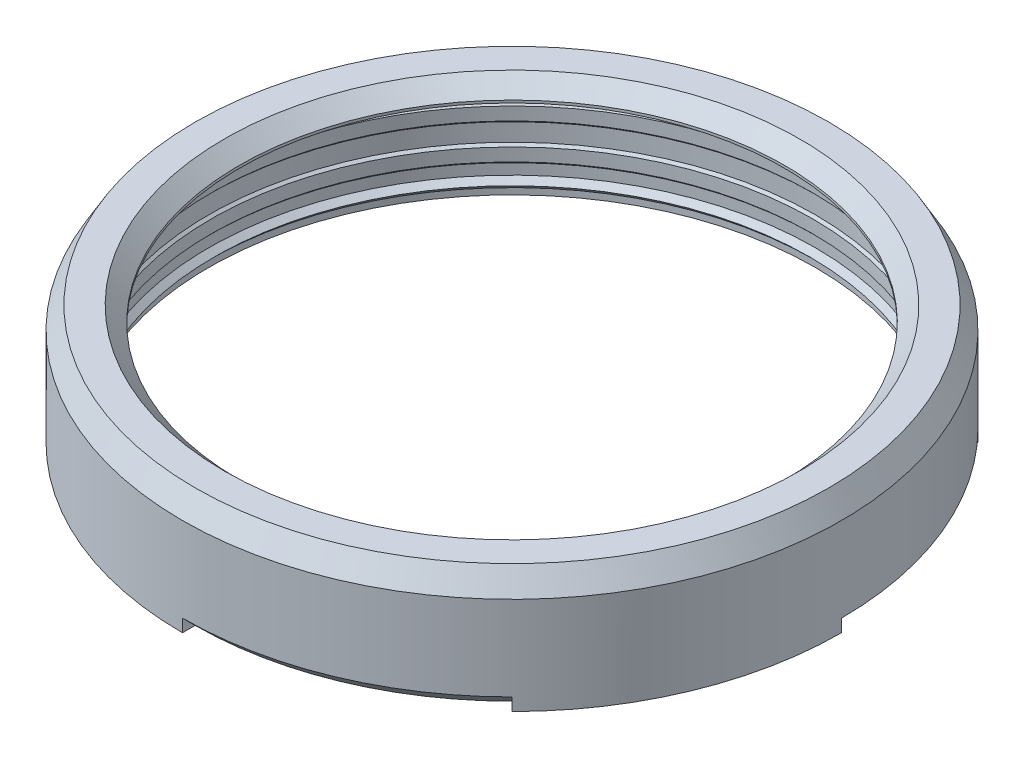
from build123d import *

# Parameters (mm, degrees)
SKETCH_1_R               = 26
EXTRUDE_1_DEPTH          = 2
SKETCH_5_R               = 21.5
CUT_EXTRUDE_1_DEPTH      = 39.105117767
CUT_EXTRUDE_START        = -0.6
SKETCH_7_R               = 26
CUT_EXTRUDE_2_DEPTH      = 0.6
CHAMFER_1_SIZE           = 1.732
CHAMFER_1_SIZE2          = 0.999970666
CHAMFER_2_SIZE           = 1.2
CUT_REVOLVE_1_ANGLE      = 45
PATTERN_CIRCULAR_1_COUNT = 4
SKETCH_9_R               = 22.78
SKETCH_9_R_2             = 22.32
EXTRUDE_2_DEPTH          = 0.5


with BuildPart() as part:
    # 草图1 → 凸台-拉伸1 (new body)
    with BuildSketch(Plane(origin=(0, 0, 0), x_dir=(1, 0, 0), z_dir=(0, 1, 0))):
        with Locations(Location((0, 0, 0), (0, 0, 270))):
            Circle(SKETCH_1_R)
    extrude(amount=EXTRUDE_1_DEPTH)

    # 草图4 → 旋转1 (revolve)
    with BuildSketch(Plane(origin=(0, 0, 0), x_dir=(0.8660254037844574, 0, 0.4999999999999675), z_dir=(-0.4999999999999675, 0, 0.8660254037844574)), mode=Mode.PRIVATE) as revolve_1_sk:
        with BuildLine():
            Line((23.93, -8), (23.93, -7.5))
            Line((23.93, -7.5), (23.505, -7.075))
            Line((23.505, -7.075), (23.93, -6.65))
            Line((23.93, -6.65), (23.93, -5.8))
            Line((23.93, -5.8), (23.74, -5.61))
            Line((23.74, -5.61), (23.74, -4.59))
            Line((23.74, -4.59), (23.93, -4.4))
            Line((23.93, -4.4), (23.93, -3))
            Line((23.93, -3), (23.74, -2.81))
            Line((23.74, -2.81), (23.74, -1.79))
            Line((23.74, -1.79), (23.93, -1.6))
            Line((23.93, -1.6), (23.93, -1.4))
            ThreePointArc((23.93, -1.4), (23.519949494, -0.410050506), (22.53, 0))
            Line((22.53, 0), (26, 0))
            Line((26, 0), (26, -8))
            Line((26, -8), (23.93, -8))
        make_face()
    revolve(revolve_1_sk.sketch.rotate(Axis((0, 0, 0), (0, 1, 0)), 120), axis=Axis((0, 0, 0), (0, 1, 0)))

    # 草图5 → 切除-拉伸1 (cut, through all)
    with BuildSketch(Plane(origin=(0, 2, 0), x_dir=(1, 0, 0), z_dir=(0, 1, 0))):
        with Locations(Location((0, 0, 0), (0, 0, 270))):
            Circle(SKETCH_5_R)
    extrude(amount=-CUT_EXTRUDE_1_DEPTH, mode=Mode.SUBTRACT)

    # 草图7 → 切除-拉伸2 (cut)
    with BuildSketch(Plane(origin=(0, 2, 0), x_dir=(1, 0, 0), z_dir=(0, 1, 0)).offset(CUT_EXTRUDE_START)):
        with Locations(Location((0, 0, 0), (0, 0, 90))):
            Circle(SKETCH_7_R)
    extrude(amount=CUT_EXTRUDE_2_DEPTH, mode=Mode.SUBTRACT)

    # 倒角1
    chamfer_1_edges = [part.edges().sort_by_distance(p)[0] for p in [
        (0, 1.4, -26),
    ]]
    chamfer_1_side = [part.faces().sort_by_distance(p)[0] for p in [
        (26, -3.3, 0),
    ]]
    chamfer(chamfer_1_edges, length=CHAMFER_1_SIZE, length2=CHAMFER_1_SIZE2, reference=chamfer_1_side[0])

    # 倒角2
    chamfer_2_edges = [part.edges().sort_by_distance(p)[0] for p in [
        (0, 1.4, -21.5),
    ]]
    chamfer(chamfer_2_edges, length=CHAMFER_2_SIZE)

    # 草图8 → 切除-旋转1 (revolve, cut)
    with BuildSketch(Plane.XY):
        Polygon((26, -8), (26, -7), (25, -8), align=None)
    cut_revolve_1 = revolve(axis=Axis((0, 0, 0), (0, 1, 0)), revolution_arc=CUT_REVOLVE_1_ANGLE, mode=Mode.SUBTRACT)

    # 阵列(圆周)1: 切除-旋转1 ×4 about axis
    pattern_circular_1_axis = Axis((0, 0, 0), (0, 1, 0))
    for i in range(1, PATTERN_CIRCULAR_1_COUNT):
        add(cut_revolve_1.rotate(pattern_circular_1_axis, i * 360 / PATTERN_CIRCULAR_1_COUNT), mode=Mode.SUBTRACT)

    # 草图9 → 凸台-拉伸2 (add)
    with BuildSketch(Plane.XZ):
        with Locations(Location((0, 0, 0), (0, 0, 270))):
            Circle(SKETCH_9_R)
        with Locations(Location((0, 0, 0), (0, 0, 270))):
            Circle(SKETCH_9_R_2, mode=Mode.SUBTRACT)
    extrude(amount=EXTRUDE_2_DEPTH)


solid = part.part
